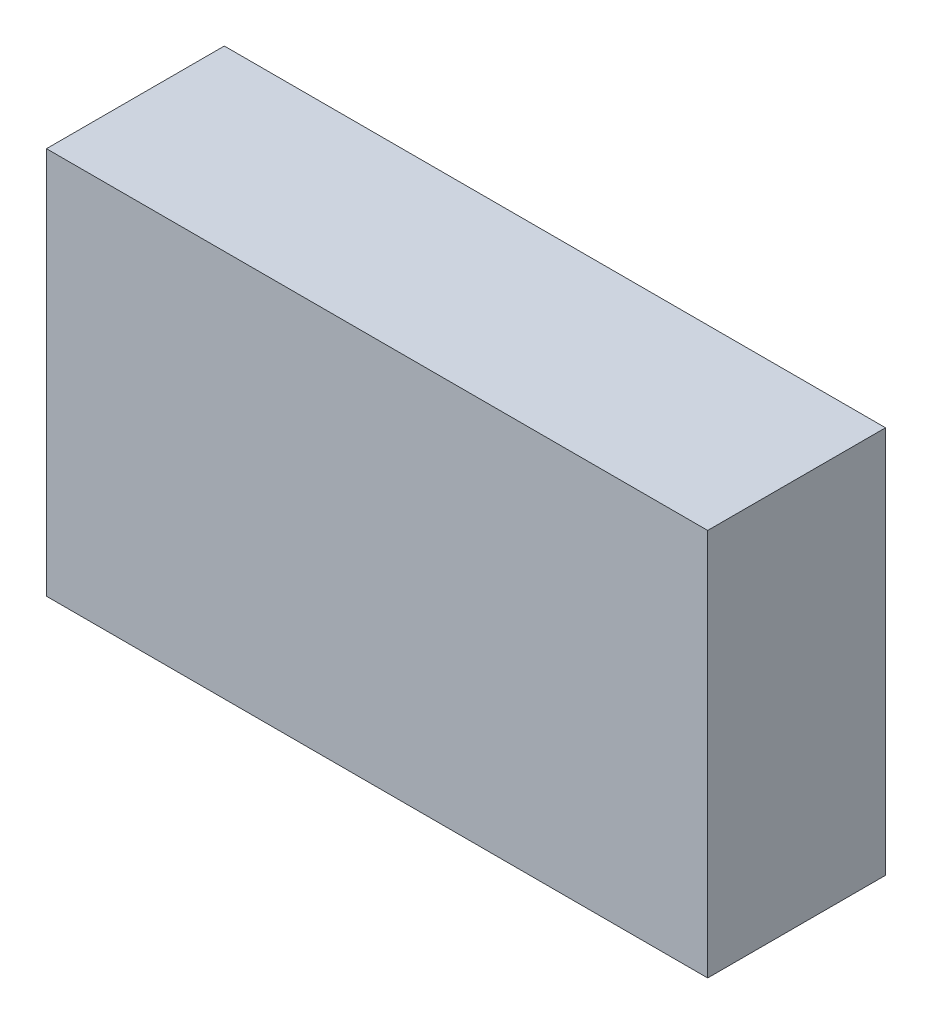
from build123d import *

# Parameters (mm, degrees)
SKETCH1_W      = 58
SKETCH1_H      = 34
ENVELOPE_DEPTH = 15.6


with BuildPart() as part:
    # Sketch1 → Envelope (new body)
    with BuildSketch(Plane.XY):
        Rectangle(SKETCH1_W, SKETCH1_H)
    extrude(amount=ENVELOPE_DEPTH)


solid = part.part
